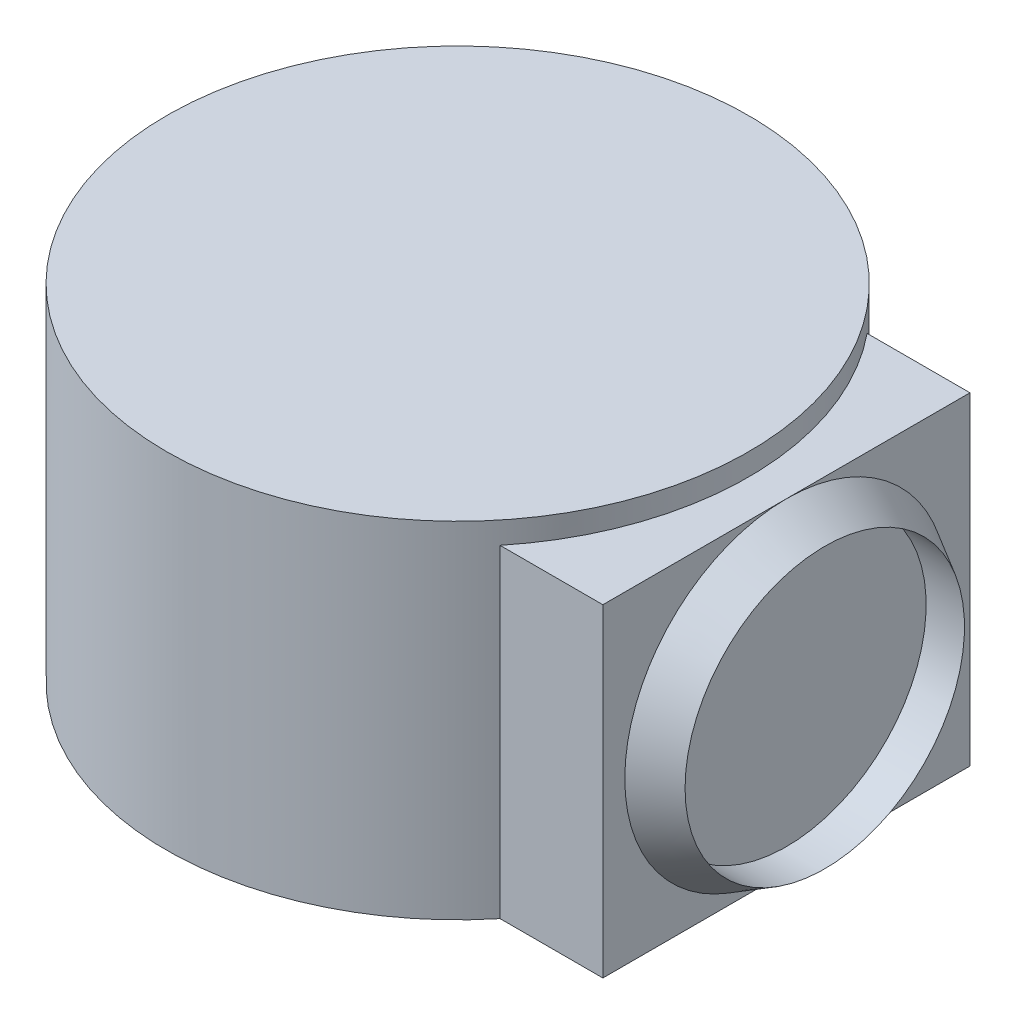
from build123d import *

# Parameters (mm, degrees)
SKETCH1_R           = 132.8125
BOSS_EXTRUDE1_DEPTH = 147.5
SKETCH2_W           = 167.5
SKETCH2_H           = 147.5
BOSS_EXTRUDE2_DEPTH = 150
SKETCH5_R           = 132.8125
BOSS_EXTRUDE3_DEPTH = 10


with BuildPart() as part:
    # Sketch1 → Boss-Extrude1 (new body)
    with BuildSketch(Plane(origin=(0, 0, 0), x_dir=(1, 0, 0), z_dir=(0, 1, 0))):
        with Locations(Location((0, 0, 0), (0, 0, 270))):
            Circle(SKETCH1_R)
    extrude(amount=BOSS_EXTRUDE1_DEPTH)

    # Sketch2 → Boss-Extrude2 (add)
    with BuildSketch(Plane(origin=(0, 0, 0), x_dir=(0, 0, -1), z_dir=(1, 0, 0))):
        with Locations((0, 73.75)):
            Rectangle(SKETCH2_W, SKETCH2_H)
    extrude(amount=BOSS_EXTRUDE2_DEPTH)

    # Sketch4 → Revolve1 (revolve)
    with BuildSketch(Plane.XY, mode=Mode.PRIVATE) as revolve1_sk:
        Polygon((150, 0), (150, 10), (167.5, 10), align=None)
    revolve(revolve1_sk.sketch.rotate(Axis((150, 73.75, 0), (1, 0, 0)), 270), axis=Axis((150, 73.75, 0), (1, 0, 0)))

    # Sketch5 → Boss-Extrude3 (add)
    with BuildSketch(Plane(origin=(0, 147.5, 0), x_dir=(1, 0, 0), z_dir=(0, 1, 0))):
        with Locations(Location((0, 0, 0), (0, 0, 39.093534815))):
            Circle(SKETCH5_R)
    extrude(amount=BOSS_EXTRUDE3_DEPTH)


solid = part.part
